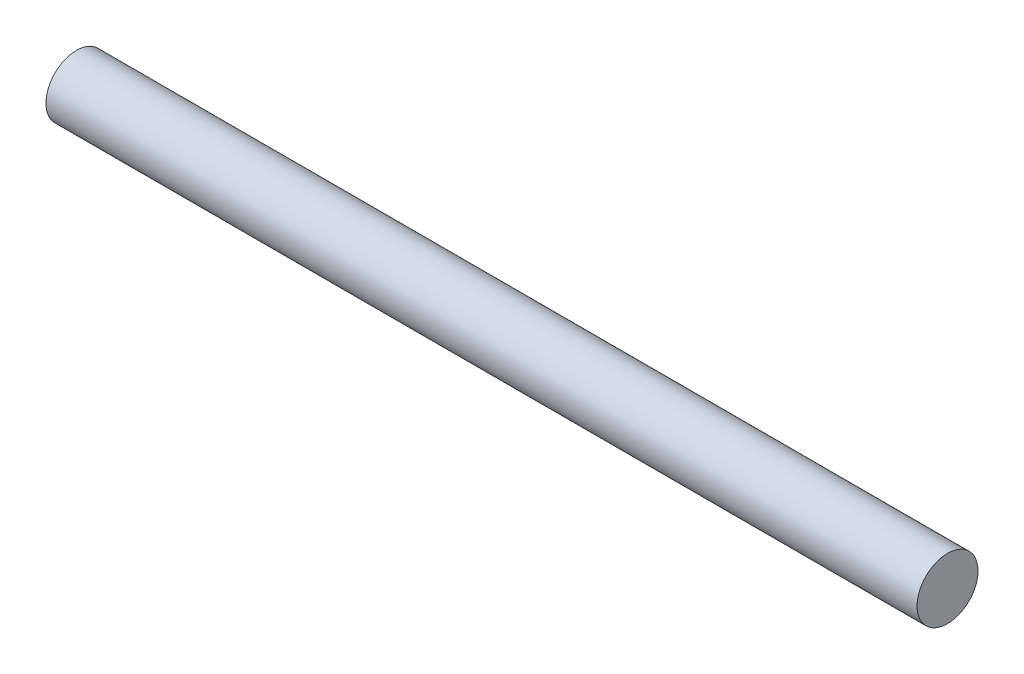
from build123d import *

# Parameters (mm, degrees)
SKETCH1_R           = 35
BOSS_EXTRUDE1_DEPTH = 1000


with BuildPart() as part:
    # Sketch1 → Boss-Extrude1 (new body)
    with BuildSketch(Plane(origin=(0, 0, 0), x_dir=(0, 0, -1), z_dir=(1, 0, 0))):
        Circle(SKETCH1_R)
    extrude(amount=BOSS_EXTRUDE1_DEPTH)


solid = part.part
